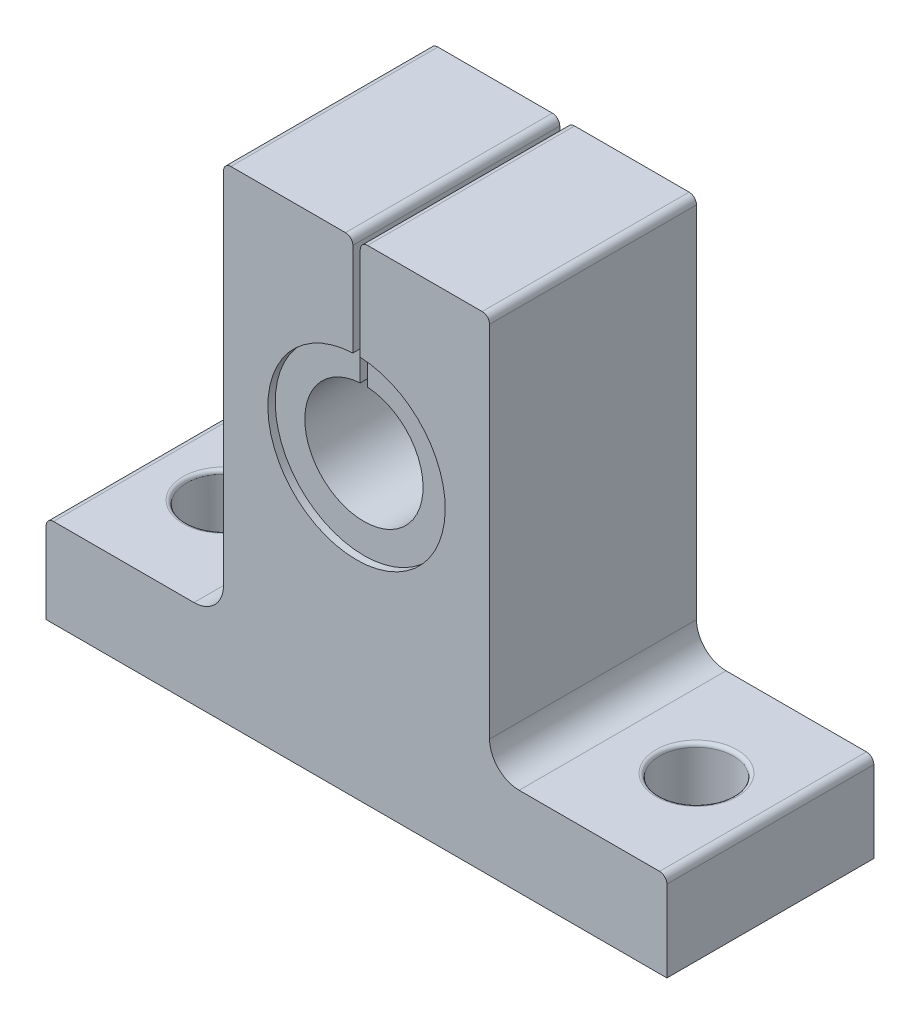
from build123d import *

# Parameters (mm, degrees)
BOSS_EXTRUDE1_DEPTH     = 14
SKETCH2_R               = 4
CUT_EXTRUDE1_DEPTH      = 42.386471219
SKETCH3_R               = 6
CUT_EXTRUDE2_DEPTH      = 0.5
CUT_EXTRUDE3_START      = -0.5
SKETCH4_R               = 6
CUT_EXTRUDE3_DEPTH      = 0.5
SKETCH5_R               = 2.5
CUT_EXTRUDE4_DEPTH      = 37.813584449
CUT_EXTRUDE5_REACH      = 43.386
CUT_EXTRUDE5_END_RADIUS = 4
SKETCH7_W               = 0.5
SKETCH7_H               = 14
FILLET1_R               = 2
FILLET2_R               = 0.5
FILLET3_R               = 0.25


with BuildPart() as part:
    # Sketch1 → Boss-Extrude1 (new body)
    with BuildSketch(Plane.XY):
        Polygon((21, 0), (-21, 0), (-21, 6), (-9, 6), (-9, 32.8), (9, 32.8), (9, 6), (21, 6), align=None)
    extrude(amount=BOSS_EXTRUDE1_DEPTH)

    # Sketch2 → Cut-Extrude1 (cut, through all)
    with BuildSketch(Plane.XY.offset(14)):
        with Locations((0, 20)):
            Circle(SKETCH2_R)
    extrude(amount=-CUT_EXTRUDE1_DEPTH, mode=Mode.SUBTRACT)

    # Sketch3 → Cut-Extrude2 (cut)
    with BuildSketch(Plane.XY.offset(14)):
        with Locations((0, 20)):
            Circle(SKETCH3_R)
    extrude(amount=-CUT_EXTRUDE2_DEPTH, mode=Mode.SUBTRACT)

    # Sketch4 → Cut-Extrude3 (cut)
    with BuildSketch(Plane(origin=(0, 0, 0), x_dir=(-1, 0, 0), z_dir=(0, 0, -1)).offset(CUT_EXTRUDE3_START)):
        with Locations(Location((0, 20, 0), (0, 0, 180))):
            Circle(SKETCH4_R)
    extrude(amount=CUT_EXTRUDE3_DEPTH, mode=Mode.SUBTRACT)

    # Sketch5 → Cut-Extrude4 (cut, through all)
    with BuildSketch(Plane(origin=(0, 6, 0), x_dir=(1, 0, 0), z_dir=(0, 1, 0))):
        with Locations(Location((-16, -7, 0), (0, 0, 270))):
            Circle(SKETCH5_R)
        with Locations(Location((16, -7, 0), (0, 0, 90))):
            Circle(SKETCH5_R)
    extrude(amount=-CUT_EXTRUDE4_DEPTH, mode=Mode.SUBTRACT)

    # Cut-Extrude5: up to this cylinder (the profile starts outside it)
    cut_extrude5_end = Plane(origin=(0, 20, 7), z_dir=(0, 0, 1)) * Cylinder(CUT_EXTRUDE5_END_RADIUS, 95.772, mode=Mode.PRIVATE)
    # Sketch7 → Cut-Extrude5 (cut, up to the surface)
    with BuildSketch(Plane(origin=(0, 32.8, 0), x_dir=(1, 0, 0), z_dir=(0, 1, 0)), mode=Mode.PRIVATE) as cut_extrude5_sk1:
        with Locations((0, -7)):
            Rectangle(SKETCH7_W, SKETCH7_H)
    cut_extrude5_tool1 = extrude(cut_extrude5_sk1.sketch, amount=-CUT_EXTRUDE5_REACH, mode=Mode.PRIVATE) - cut_extrude5_end
    add(cut_extrude5_tool1.solids().sort_by_distance((0, 32.8, 7))[0], mode=Mode.SUBTRACT)

    # Fillet1
    fillet1_edges = [part.edges().sort_by_distance(p)[0] for p in [
        (-9, 6, 7),
        (9, 6, 7),
    ]]
    fillet(fillet1_edges, radius=FILLET1_R)

    # Fillet2
    fillet2_edges = [part.edges().sort_by_distance(p)[0] for p in [
        (-9, 32.8, 7),
        (9, 32.8, 7),
        (21, 6, 7),
        (-21, 6, 7),
        (-0.25, 32.8, 7),
        (0.25, 32.8, 7),
    ]]
    fillet(fillet2_edges, radius=FILLET2_R)

    # Fillet3
    fillet3_edges = [part.edges().sort_by_distance(p)[0] for p in [
        (-16, 6, 4.5),
        (16, 6, 9.5),
    ]]
    fillet(fillet3_edges, radius=FILLET3_R)


solid = part.part
